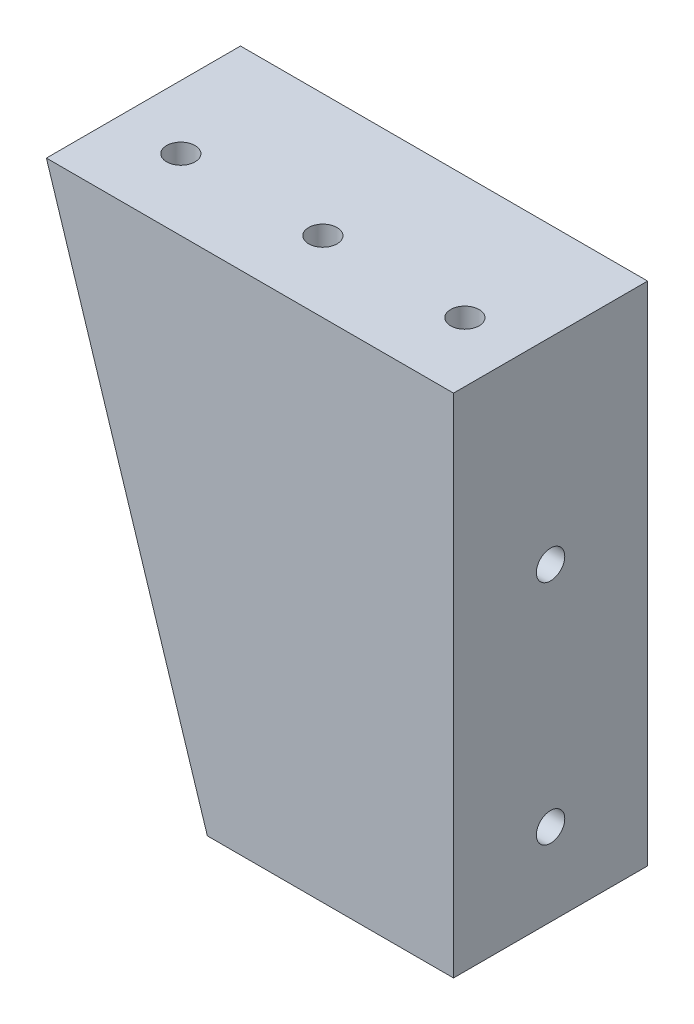
from build123d import *

# Parameters (mm, degrees)
BOSS_EXTRUDE2_DEPTH = 15
SKETCH5_R           = 1.5
CUT_EXTRUDE3_DEPTH  = 8
BOSS_EXTRUDE4_DEPTH = 5.5
SKETCH8_R           = 1.5
CUT_EXTRUDE4_DEPTH  = 10
SKETCH9_R           = 1.5
CUT_EXTRUDE5_DEPTH  = 7
SKETCH5_4_R         = 1.5
CUT_EXTRUDE6_DEPTH  = 10
SKETCH10_W          = 5.6
SKETCH10_H          = 2.4
SKETCH10_W_2        = 5.5
CUT_EXTRUDE7_DEPTH  = 24
SKETCH10_3_W        = 5.6
SKETCH10_3_H        = 2.4
SKETCH10_3_W_2      = 5.5
BOSS_EXTRUDE5_DEPTH = 4.2


with BuildPart() as part:
    # Sketch3 → Boss-Extrude2 (new body)
    with BuildSketch(Plane.XY):
        Polygon((380.706426849, -77.512840587), (380.706426849, -131.012840587), (354.706426849, -131.012840587), (337.706426849, -77.512840587), align=None)
    extrude(amount=BOSS_EXTRUDE2_DEPTH)

    # Sketch5 → Cut-Extrude3 (cut)
    with BuildSketch(Plane(origin=(0, -77.512840587, 0), x_dir=(1, 0, 0), z_dir=(0, 1, 0))):
        with Locations((344.406426849, -7.5)):
            Circle(SKETCH5_R)
        with Locations((359.406426849, -7.5)):
            Circle(SKETCH5_R)
        with Locations((374.406426849, -7.5)):
            Circle(SKETCH5_R)
    extrude(amount=-CUT_EXTRUDE3_DEPTH, mode=Mode.SUBTRACT)

    # Sketch7 → Boss-Extrude4 (add)
    with BuildSketch(Plane(origin=(0, 0, 0), x_dir=(-1, 0, 0), z_dir=(0, 0, -1))):
        Polygon((-380.706426849, -77.512840587), (-337.706426849, -77.512840587), (-354.706426849, -131.012840587), (-380.706426849, -131.012840587), align=None)
    extrude(amount=BOSS_EXTRUDE4_DEPTH)

    # Sketch8 → Cut-Extrude4 (cut)
    with BuildSketch(Plane(origin=(380.706426849, 0, 0), x_dir=(0, 0, -1), z_dir=(1, 0, 0))):
        with Locations((-4.75, -98.312840587)):
            Circle(SKETCH8_R)
        with Locations((-4.75, -122.312840587)):
            Circle(SKETCH8_R)
    extrude(amount=-CUT_EXTRUDE4_DEPTH, mode=Mode.SUBTRACT)

    # Sketch9 → Cut-Extrude5 (cut)
    with BuildSketch(Plane(origin=(0, -131.012840587, 0), x_dir=(-1, 0, 0), z_dir=(0, -1, 0))):
        with Locations((-361.706426849, -4.75)):
            Circle(SKETCH9_R)
        with Locations((-373.706426849, -4.75)):
            Circle(SKETCH9_R)
    extrude(amount=-CUT_EXTRUDE5_DEPTH, mode=Mode.SUBTRACT)

    # Sketch5<4> → Cut-Extrude6 (cut)
    with BuildSketch(Plane(origin=(0, -77.512840587, 0), x_dir=(1, 0, 0), z_dir=(0, 1, 0))):
        with Locations((359.406426849, -7.5)):
            Circle(SKETCH5_4_R)
        with Locations((374.406426849, -7.5)):
            Circle(SKETCH5_4_R)
    extrude(amount=-CUT_EXTRUDE6_DEPTH, mode=Mode.SUBTRACT)

    # Sketch10 → Cut-Extrude7 (cut)
    with BuildSketch(Plane.XY.offset(15)):
        with Locations((359.312441298, -85.248108343)):
            Rectangle(SKETCH10_W, SKETCH10_H)
        with Locations((374.333669077, -85.248108343)):
            Rectangle(SKETCH10_W_2, SKETCH10_H)
    extrude(amount=-CUT_EXTRUDE7_DEPTH, mode=Mode.SUBTRACT)

    # Sketch10<3> → Boss-Extrude5 (add)
    with BuildSketch(Plane.XY.offset(15)):
        with Locations((359.312441298, -85.248108343)):
            Rectangle(SKETCH10_3_W, SKETCH10_3_H)
        with Locations((374.333669077, -85.248108343)):
            Rectangle(SKETCH10_3_W_2, SKETCH10_3_H)
    extrude(amount=-BOSS_EXTRUDE5_DEPTH)


solid = part.part
